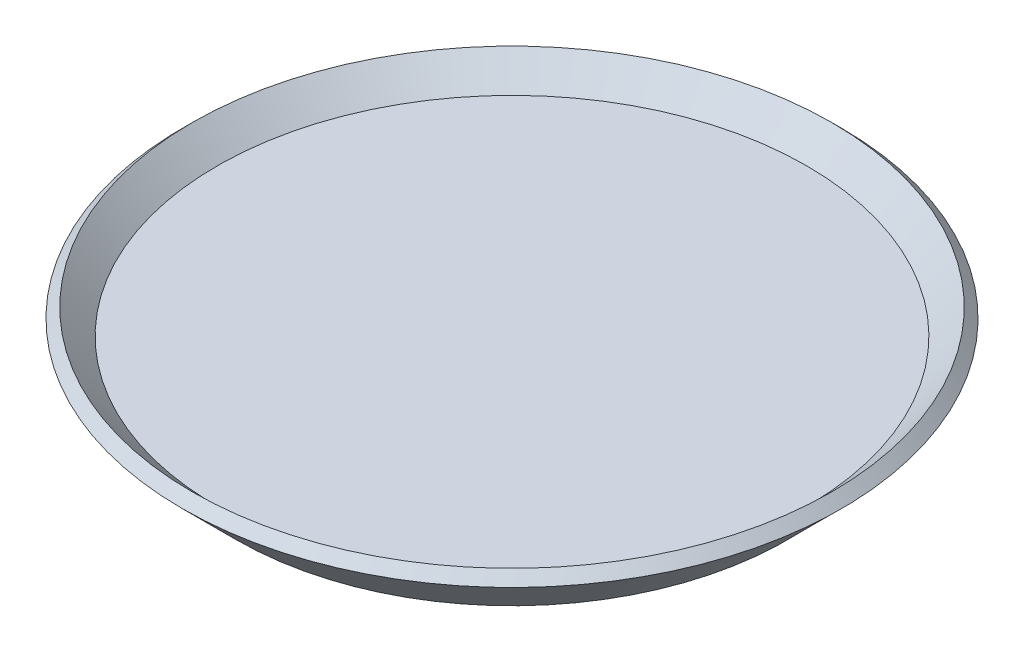
from build123d import *


with BuildPart() as part:
    # Sketch1 → Revolve1 (revolve)
    with BuildSketch(Plane.XY, mode=Mode.PRIVATE) as revolve1_sk:
        Polygon((0, 0), (100, 0), (119.618340286, 19.618340286), (116.08280638, 23.153874192), (107.005869284, 14.076937096), (0, 14.076937096), (0, 5), align=None)
    revolve(revolve1_sk.sketch.rotate(Axis((0, -54.675, 0), (0, 1, 0)), 90), axis=Axis((0, -54.675, 0), (0, 1, 0)))


solid = part.part
